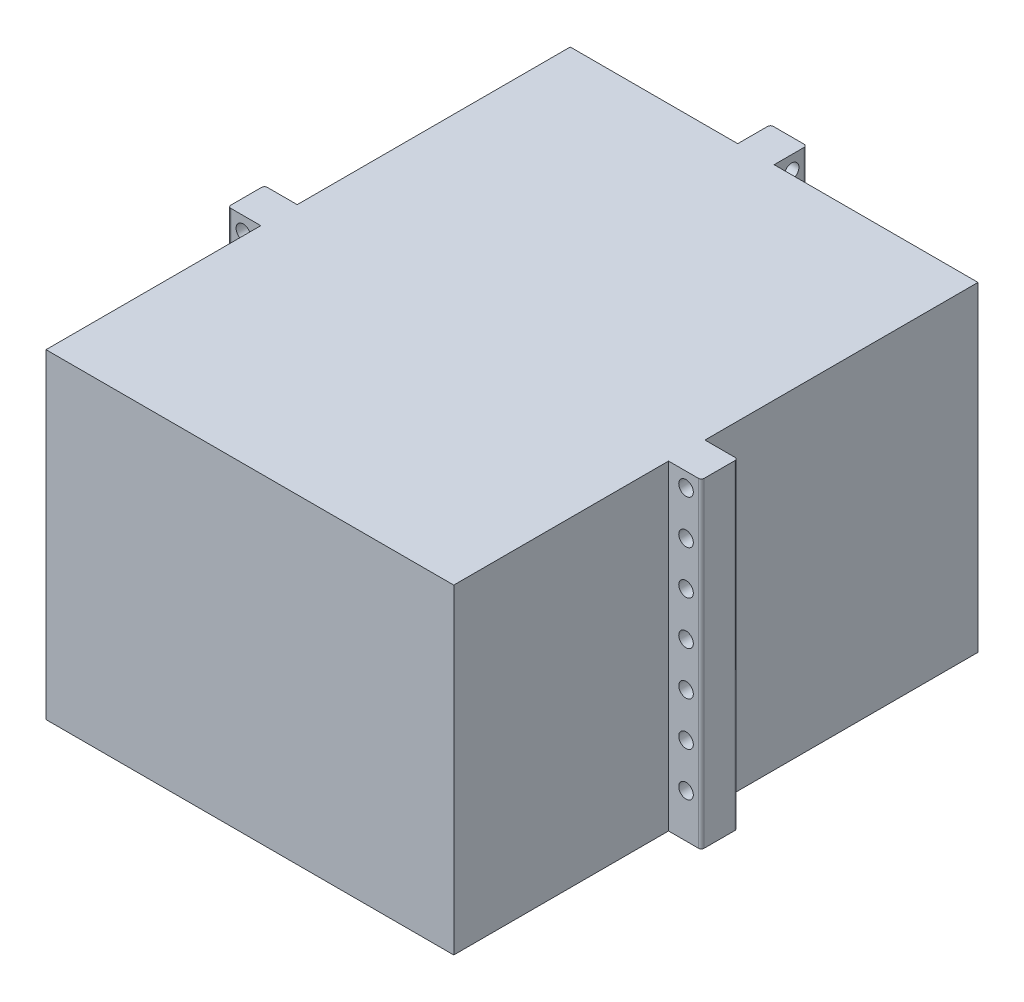
from build123d import *

# Parameters (mm, degrees)
BOSS_EXTRUDE1_DEPTH = 279.4
SKETCH2_R           = 6.35
CUT_EXTRUDE1_DEPTH  = 45.72
SKETCH3_R           = 6.35
CUT_EXTRUDE2_DEPTH  = 45.72
FILLET1_R           = 2.54


with BuildPart() as part:
    # Sketch1 → Boss-Extrude1 (new body)
    with BuildSketch(Plane(origin=(0, 0, 0), x_dir=(1, 0, 0), z_dir=(0, 1, 0))):
        Polygon((-177.8, -228.6), (-31.75, -228.6), (31.75, -228.6), (177.8, -228.6), (177.8, -41.275), (206.375, -41.275), (206.375, -9.525), (177.8, -9.525), (177.8, 228.6), (0, 228.6), (0, 257.175), (-31.75, 257.175), (-31.75, 228.6), (-177.8, 228.6), (-177.8, -9.525), (-206.375, -9.525), (-206.375, -41.275), (-177.8, -41.275), align=None)
    extrude(amount=BOSS_EXTRUDE1_DEPTH)

    # Sketch2 → Cut-Extrude1 (cut)
    with BuildSketch(Plane.XY.offset(41.275)):
        with Locations((-193.04, 38.1)):
            Circle(SKETCH2_R)
        with Locations((-193.04, 76.2)):
            Circle(SKETCH2_R)
        with Locations((-193.04, 114.3)):
            Circle(SKETCH2_R)
        with Locations((-193.04, 152.4)):
            Circle(SKETCH2_R)
        with Locations((-193.04, 190.5)):
            Circle(SKETCH2_R)
        with Locations((-193.04, 228.6)):
            Circle(SKETCH2_R)
        with Locations((-193.04, 266.7)):
            Circle(SKETCH2_R)
        with Locations((193.04, 266.7)):
            Circle(SKETCH2_R)
        with Locations((193.04, 228.6)):
            Circle(SKETCH2_R)
        with Locations((193.04, 190.5)):
            Circle(SKETCH2_R)
        with Locations((193.04, 152.4)):
            Circle(SKETCH2_R)
        with Locations((193.04, 114.3)):
            Circle(SKETCH2_R)
        with Locations((193.04, 76.2)):
            Circle(SKETCH2_R)
        with Locations((193.04, 38.1)):
            Circle(SKETCH2_R)
    extrude(amount=-CUT_EXTRUDE1_DEPTH, mode=Mode.SUBTRACT)

    # Sketch3 → Cut-Extrude2 (cut)
    with BuildSketch(Plane.ZY.offset(31.75)):
        with Locations((-243.84, 38.1)):
            Circle(SKETCH3_R)
        with Locations((-243.84, 76.2)):
            Circle(SKETCH3_R)
        with Locations((-243.84, 114.3)):
            Circle(SKETCH3_R)
        with Locations((-243.84, 152.4)):
            Circle(SKETCH3_R)
        with Locations((-243.84, 190.5)):
            Circle(SKETCH3_R)
        with Locations((-243.84, 228.6)):
            Circle(SKETCH3_R)
        with Locations((-243.84, 266.7)):
            Circle(SKETCH3_R)
    extrude(amount=-CUT_EXTRUDE2_DEPTH, mode=Mode.SUBTRACT)

    # Fillet1
    fillet1_edges = [part.edges().sort_by_distance(p)[0] for p in [
        (206.375, 139.7, 41.275),
        (206.375, 139.7, 9.525),
        (0, 139.7, -257.175),
        (-31.75, 139.7, -257.175),
        (-206.375, 139.7, 41.275),
        (-206.375, 139.7, 9.525),
    ]]
    fillet(fillet1_edges, radius=FILLET1_R)


solid = part.part
